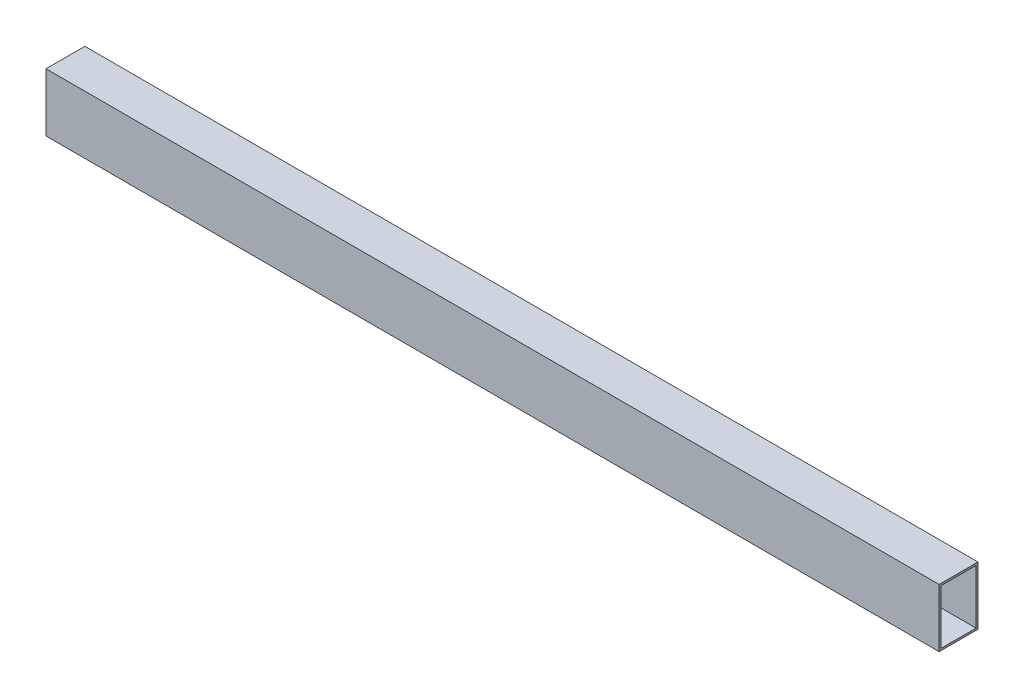
from build123d import *

# Parameters (mm, degrees)
SKETCH_11_W       = 20
SKETCH_11_H       = 30
SKETCH_11_W_2     = 18
SKETCH_11_H_2     = 28
F_20X30X1_1_DEPTH = 460


with BuildPart() as part:
    # 草图11 → 铝管 20X30X1(1) (new body)
    with BuildSketch(Plane(origin=(0, 0, 0), x_dir=(0, 0, -1), z_dir=(1, 0, 0))):
        Rectangle(SKETCH_11_W, SKETCH_11_H)
        Rectangle(SKETCH_11_W_2, SKETCH_11_H_2, mode=Mode.SUBTRACT)
    extrude(amount=F_20X30X1_1_DEPTH)


solid = part.part
